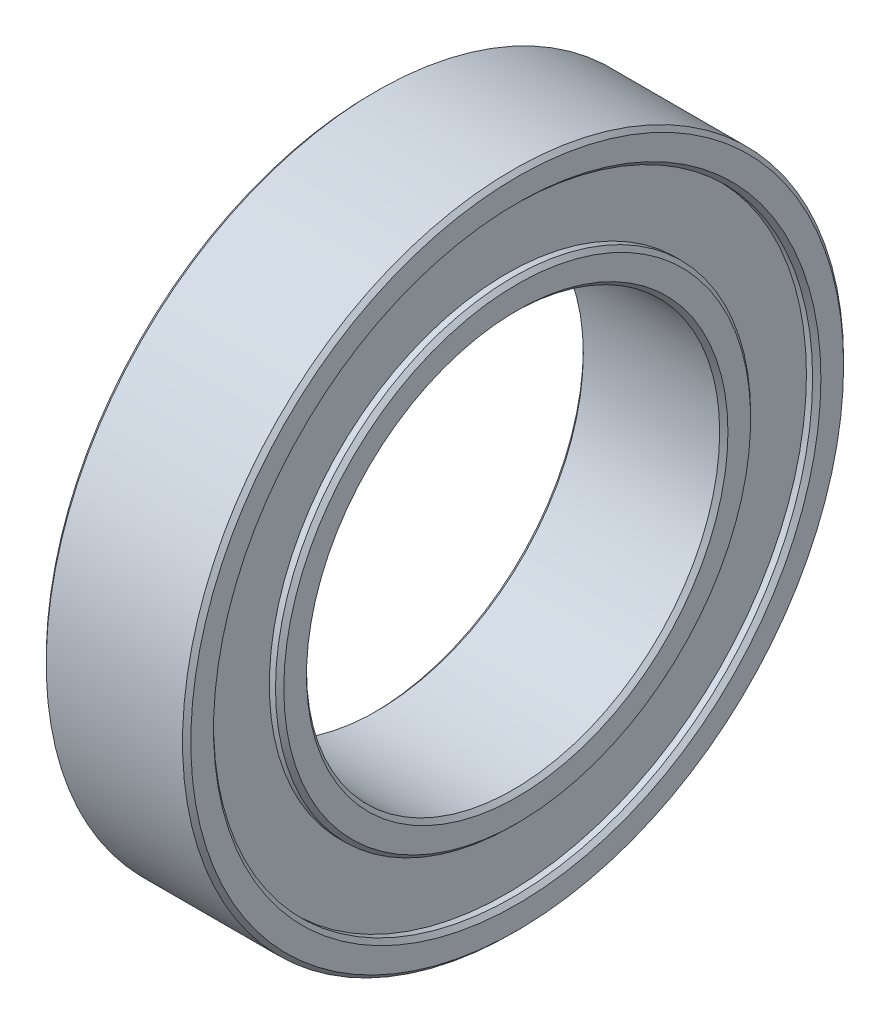
from build123d import *

# Parameters (mm, degrees)
SKETCH1_R           = 16
SKETCH1_R_2         = 10
BOSS_EXTRUDE1_DEPTH = 3.5
SKETCH2_R           = 14.5
SKETCH2_R_2         = 11.5
CUT_EXTRUDE1_DEPTH  = 0.5
CHAMFER1_SIZE       = 0.2


with BuildPart() as part:
    # Sketch1 → Boss-Extrude1 (new, symmetric)
    with BuildSketch(Plane(origin=(0, 0, 0), x_dir=(0, 0, -1), z_dir=(1, 0, 0))):
        Circle(SKETCH1_R)
        Circle(SKETCH1_R_2, mode=Mode.SUBTRACT)
    extrude(amount=BOSS_EXTRUDE1_DEPTH, both=True)

    # Sketch2 → Cut-Extrude1 (cut)
    with BuildSketch(Plane(origin=(3.5, 0, 0), x_dir=(0, 0, -1), z_dir=(1, 0, 0))):
        Circle(SKETCH2_R)
        Circle(SKETCH2_R_2, mode=Mode.SUBTRACT)
    cut_extrude1 = extrude(amount=-CUT_EXTRUDE1_DEPTH, mode=Mode.SUBTRACT)

    # Mirror1: Cut-Extrude1 across plane
    add(cut_extrude1.mirror(Plane(origin=(0, 0, 0), x_dir=(0, 0, 1), z_dir=(1, 0, 0))), mode=Mode.SUBTRACT)

    # Chamfer1
    chamfer1_edges = [part.edges().sort_by_distance(p)[0] for p in [
        (3.5, 0, 14.5),
        (3.5, 0, 11.5),
        (-3.5, 0, 11.5),
        (-3.5, 0, 14.5),
        (-3.5, 0, 16),
        (3.5, 0, 16),
        (-3.5, 0, 10),
        (3.5, 0, 10),
    ]]
    chamfer(chamfer1_edges, length=CHAMFER1_SIZE)


solid = part.part
